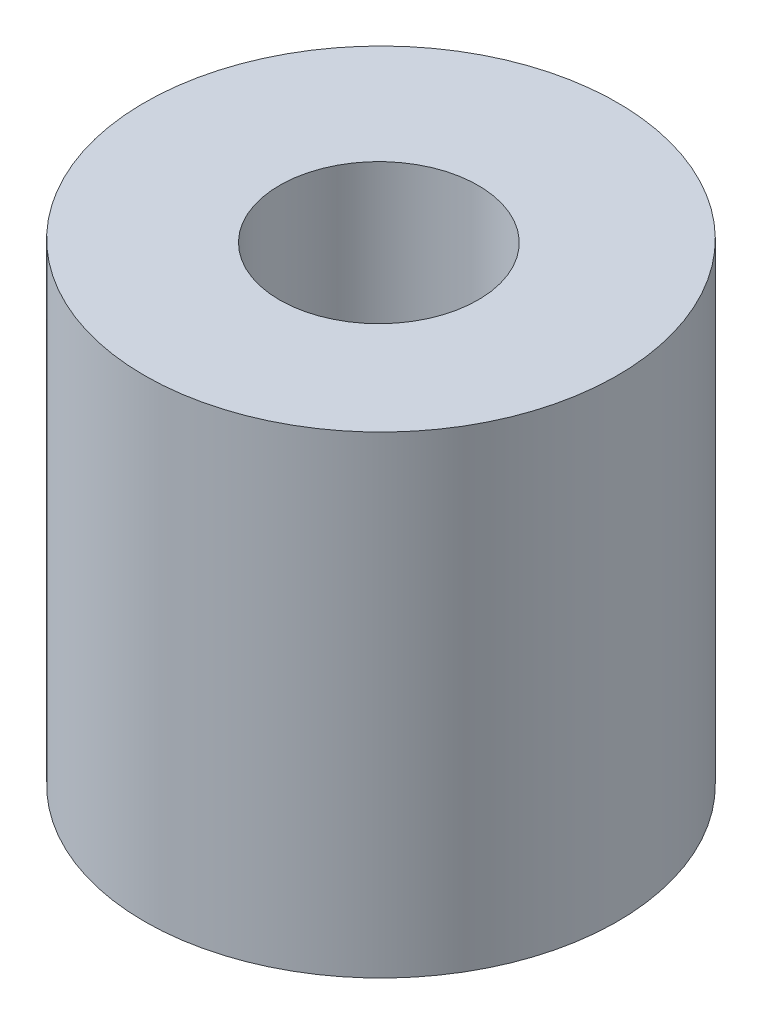
from build123d import *

# Parameters (mm, degrees)
SKETCH_1_R      = 2.5
SKETCH_1_R_2    = 1.05
EXTRUDE_1_DEPTH = 5


with BuildPart() as part:
    # 草图1 → 凸台-拉伸1 (new body)
    with BuildSketch(Plane(origin=(0, 0, 0), x_dir=(1, 0, 0), z_dir=(0, 1, 0))):
        with Locations(Location((0, 0.033152385, 0), (0, 0, 270))):
            Circle(SKETCH_1_R)
        with Locations(Location((0.02210159, -0.011050795, 0), (0, 0, 270))):
            Circle(SKETCH_1_R_2, mode=Mode.SUBTRACT)
    extrude(amount=EXTRUDE_1_DEPTH)


solid = part.part
